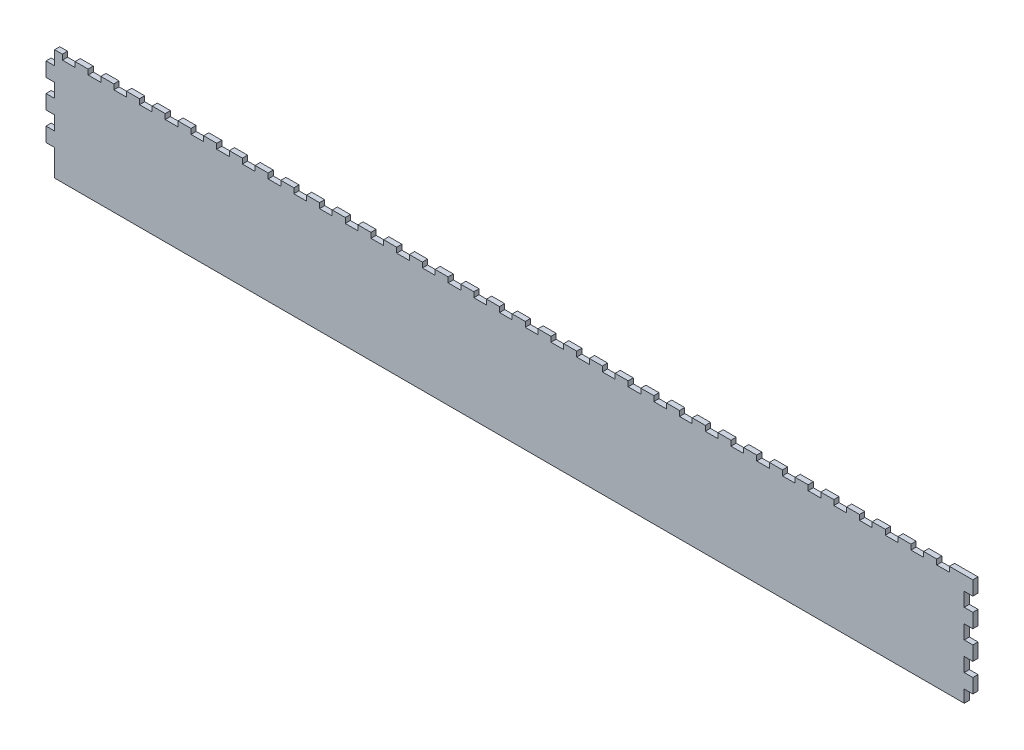
from build123d import *

# Parameters (mm, degrees)
BOSS_EXTRUDE1_DEPTH = 3


with BuildPart() as part:
    # Sketch1 → Boss-Extrude1 (new body)
    with BuildSketch(Plane.XY):
        Polygon((4.999668, 15.394029), (4.999668, 0), (533.359842, 0), (533.359842, 7.161228), (538.359861, 7.161228), (538.359861, 15.461228), (533.359842, 15.461228), (533.359842, 23.561228), (538.359861, 23.561228), (538.359861, 31.861228), (533.359842, 31.861228), (533.359842, 39.961228), (538.359861, 39.961228), (538.359861, 48.261228), (533.359842, 48.261228), (533.359842, 56.361228), (538.359861, 56.361228), (538.359861, 64.599998), (524.741368, 64.599998), (524.741368, 61.599976), (517.372941, 61.599976), (517.372941, 64.599998), (509.804503, 64.599998), (509.804503, 61.599976), (502.43602, 61.599976), (502.43602, 64.599998), (494.86761, 64.599998), (494.86761, 61.599976), (487.499126, 61.599976), (487.499126, 64.599998), (479.93066, 64.599998), (479.93066, 61.599976), (472.562233, 61.599976), (472.562233, 64.599998), (464.993767, 64.599998), (464.993767, 61.599976), (457.62534, 61.599976), (457.62534, 64.599998), (450.056704, 64.599998), (450.056704, 61.599976), (442.688587, 61.599976), (442.688587, 64.599998), (435.120093, 64.599998), (435.120093, 61.599976), (427.751638, 61.599976), (427.751638, 64.599998), (420.183143, 64.599998), (420.183143, 61.599976), (412.81466, 61.599976), (412.81466, 64.599998), (405.246165, 64.599998), (405.246165, 61.599976), (397.87771, 61.599976), (397.87771, 64.599998), (390.309215, 64.599998), (390.309215, 61.599976), (382.940732, 61.599976), (382.940732, 64.599998), (375.372237, 64.599998), (375.372237, 61.599976), (368.003782, 61.599976), (368.003782, 64.599998), (360.435626, 64.599998), (360.435626, 61.599976), (353.067171, 61.599976), (353.067171, 64.599998), (345.498648, 64.599998), (345.498648, 61.599976), (338.130193, 61.599976), (338.130193, 64.599998), (330.561699, 64.599998), (330.561699, 61.599976), (323.193243, 61.599976), (323.193243, 64.599998), (315.624721, 64.599998), (315.624721, 61.599976), (308.256265, 61.599976), (308.256265, 64.599998), (300.687771, 64.599998), (300.687771, 61.599976), (293.319315, 61.599976), (293.319315, 64.599998), (285.750793, 64.599998), (285.750793, 61.599976), (278.382337, 61.599976), (278.382337, 64.599998), (270.814182, 64.599998), (270.814182, 61.599976), (263.445726, 61.599976), (263.445726, 64.599998), (255.877232, 64.599998), (255.877232, 61.599976), (248.508777, 61.599976), (248.508748, 64.599998), (240.940282, 64.599998), (240.940282, 61.599976), (233.571799, 61.599976), (233.571799, 64.599998), (226.003304, 64.599998), (226.003304, 61.599976), (218.634849, 61.599976), (218.634821, 64.599998), (211.066354, 64.599998), (211.066354, 61.599976), (203.697871, 61.599976), (203.697871, 64.599998), (196.129743, 64.599998), (196.129743, 61.599976), (188.76126, 61.599976), (188.76126, 64.599998), (181.192765, 64.599998), (181.192765, 61.599976), (173.82431, 61.599976), (173.82431, 64.599998), (166.255815, 64.599998), (166.255815, 61.599976), (158.887332, 61.599976), (158.887332, 64.599998), (151.318837, 64.599998), (151.318837, 61.599976), (143.950382, 61.599976), (143.950382, 64.599998), (136.381859, 64.599998), (136.381859, 61.599976), (129.013404, 61.599976), (129.013404, 64.599998), (121.44491, 64.599998), (121.44491, 61.599976), (114.07644, 61.599976), (114.07644, 64.599998), (106.508299, 64.599998), (106.508299, 61.599976), (99.139829, 61.599976), (99.139829, 64.599998), (91.571335, 64.599998), (91.571335, 61.599976), (84.202865, 61.599976), (84.202865, 64.599998), (76.634371, 64.599998), (76.634371, 61.599976), (69.265901, 61.599976), (69.265901, 64.599998), (61.697407, 64.599998), (61.697407, 61.599976), (54.328937, 61.599976), (54.328937, 64.599998), (46.760443, 64.599998), (46.760443, 61.599976), (39.391974, 61.599976), (39.391974, 64.599998), (31.823479, 64.599998), (31.823479, 61.599976), (24.455362, 61.599976), (24.455362, 64.599998), (16.886868, 64.599998), (16.886868, 61.599976), (9.518399, 61.599976), (9.518399, 64.599998), (4.999668, 64.599998), (4.999668, 56.45419), (0, 56.45419), (0, 48.164931), (4.999668, 48.164931), (4.999668, 40.075652), (0, 40.075652), (0, 31.786393), (4.999668, 31.786393), (4.999668, 23.683291), (0, 23.683291), (0, 15.394029), align=None)
    extrude(amount=BOSS_EXTRUDE1_DEPTH)


solid = part.part
